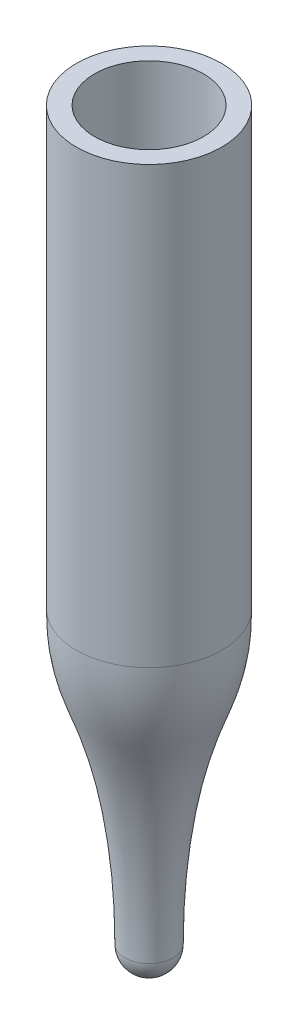
from build123d import *


with BuildPart() as part:
    # Esquisse1 → Révolution1 (revolve)
    with BuildSketch(Plane.XY, mode=Mode.PRIVATE) as r_volution1_sk:
        with BuildLine():
            Line((3, 31), (3, 13))
            add(Edge.make_bspline(
                [(3, 13), (3, 10.828758266), (1.909740875, 9.139005261), (1, 4.312648173), (1, 1)],
                knots=[0, 0, 0, 0, 0.47748099, 1, 1, 1, 1], degree=3))
            ThreePointArc((1, 1), (0.707106781, 0.292893219), (0, 0))
            Line((0, 0), (0, 0.75))
            ThreePointArc((0, 0.75), (0.176776695, 0.823223305), (0.25, 1))
            add(Edge.make_bspline(
                [(2.25, 13), (2.25, 12.871737196), (2.245787574, 12.606951452), (2.222038955, 12.143851429), (2.166520076, 11.631917095), (2.066483378, 11.10563901), (1.895459566, 10.465643066), (1.614449871, 9.691395741), (1.208823224, 8.54637983), (0.833436633, 7.090662144), (0.520883429, 5.357160432), (0.341470293, 3.671860451), (0.263896436, 2.196984926), (0.25, 1.39355257), (0.25, 1)],
                knots=[0, 0, 0, 0, 0.03125, 0.0625, 0.125, 0.1875, 0.25, 0.375, 0.5, 0.625, 0.75, 0.875, 0.9375, 1, 1, 1, 1], degree=3))
            Line((2.25, 13), (2.25, 31))
            Line((2.25, 31), (3, 31))
        make_face()
    revolve(r_volution1_sk.sketch.rotate(Axis((0, 0, 0), (0, 1, 0)), 90), axis=Axis((0, 0, 0), (0, 1, 0)))


solid = part.part
